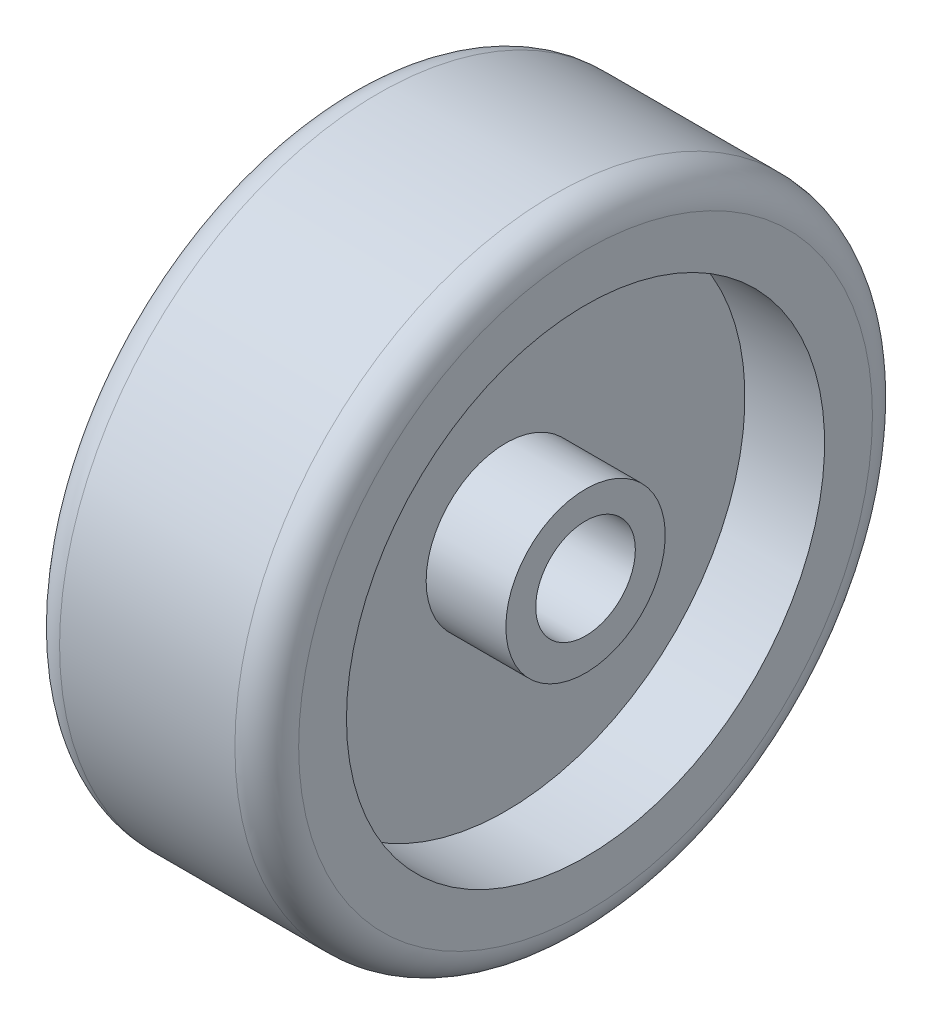
from build123d import *

# Parameters (mm, degrees)
SKETCH2_R          = 15.875
CUT_EXTRUDE1_DEPTH = 164.096082187
FILLET2_R          = 10.16
FILLET3_R          = 10.16


with BuildPart() as part:
    # Sketch1 → Revolve2 (revolve)
    with BuildSketch(Plane.XY, mode=Mode.PRIVATE) as revolve2_sk:
        Polygon((-38.1, -0.729526652), (-38.1, 24.670473348), (-12.7, 24.670473348), (-12.7, 75.470473348), (-38.1, 75.470473348), (-38.1, 100.870473348), (38.1, 100.870473348), (38.1, 75.470473348), (12.7, 75.470473348), (12.7, 24.670473348), (38.1, 24.670473348), (38.1, -0.729526652), align=None)
    revolve(revolve2_sk.sketch.rotate(Axis((-38.1, -0.729526652, 0), (1, 0, 0)), 90), axis=Axis((-38.1, -0.729526652, 0), (1, 0, 0)))

    # Sketch2 → Cut-Extrude1 (cut, through all)
    with BuildSketch(Plane(origin=(38.1, 0, 0), x_dir=(0, 0, -1), z_dir=(1, 0, 0))):
        Circle(SKETCH2_R)
    extrude(amount=-CUT_EXTRUDE1_DEPTH, mode=Mode.SUBTRACT)

    # Fillet2
    fillet2_edges = [part.edges().sort_by_distance(p)[0] for p in [
        (38.1, -0.729526652, -101.6),
    ]]
    fillet(fillet2_edges, radius=FILLET2_R)

    # Fillet3
    fillet3_edges = [part.edges().sort_by_distance(p)[0] for p in [
        (-38.1, -0.729526652, -101.6),
    ]]
    fillet(fillet3_edges, radius=FILLET3_R)


solid = part.part
